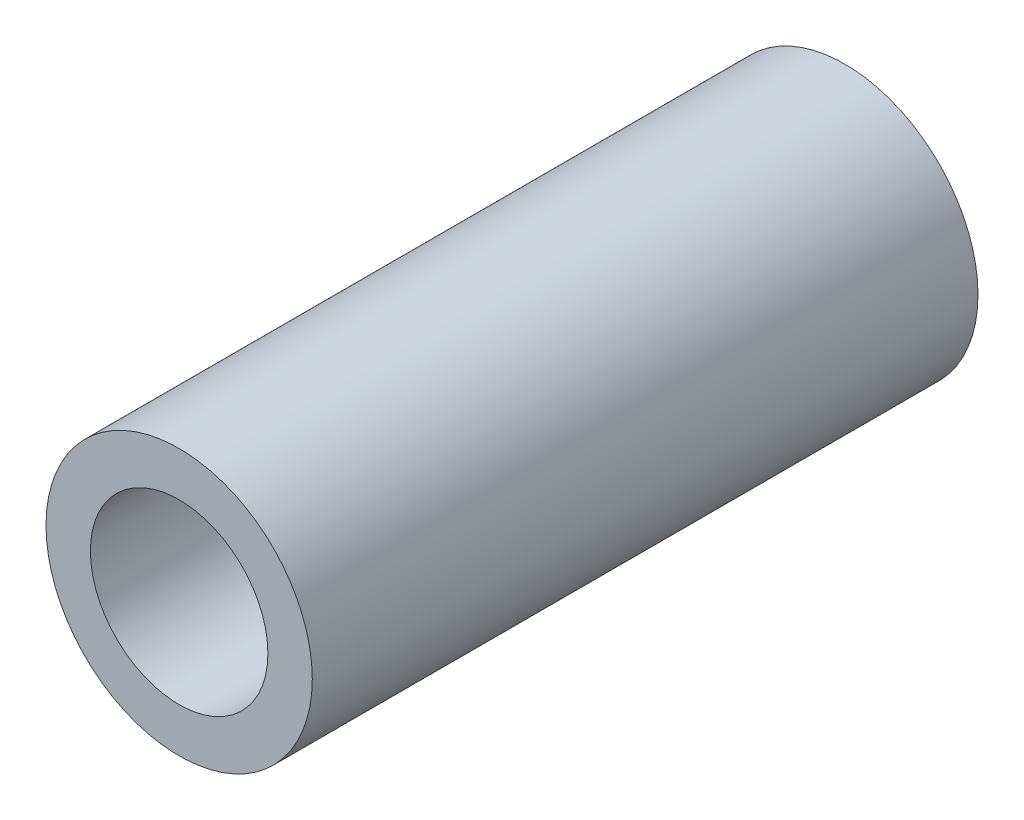
from build123d import *

# Parameters (mm, degrees)
SKETCH1_R           = 3
SKETCH1_R_2         = 2
BOSS_EXTRUDE1_DEPTH = 15


with BuildPart() as part:
    # Sketch1 → Boss-Extrude1 (new body)
    with BuildSketch(Plane.XY):
        Circle(SKETCH1_R)
        Circle(SKETCH1_R_2, mode=Mode.SUBTRACT)
    extrude(amount=BOSS_EXTRUDE1_DEPTH)


solid = part.part
